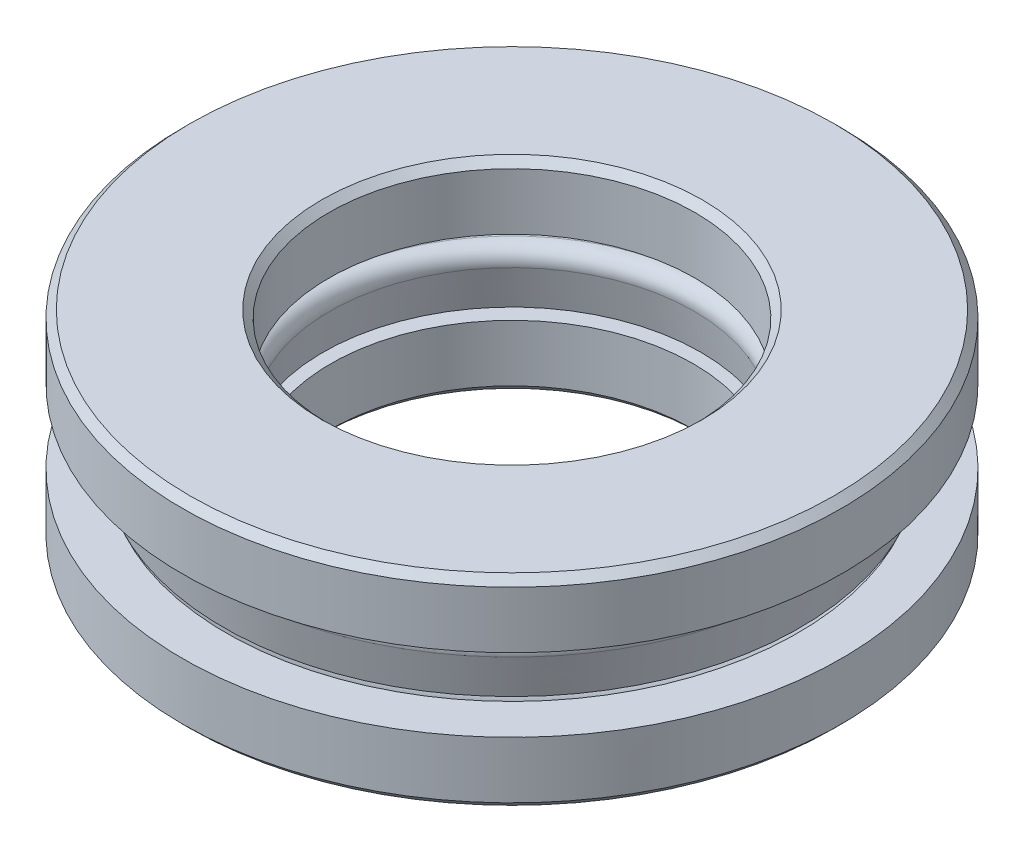
from build123d import *

# Parameters (mm, degrees)
PATTERN_CIRCULAR_2_COUNT = 8
CHAMFER_1_SIZE           = 0.2
CHAMFER_2_SIZE           = 0.2


with BuildPart() as part:
    # 草图4 → 旋转1 (revolve)
    with BuildSketch(Plane(origin=(0, 0, 0), x_dir=(0, 0, -1), z_dir=(1, 0, 0)), mode=Mode.PRIVATE) as revolve_1_sk:
        with BuildLine():
            Line((-4.95, -2.75), (-4.95, -1))
            Line((-4.95, -1), (-5.5, -1))
            ThreePointArc((-5.5, -1), (-6.65, -1.280202712), (-7.8, -1))
            Line((-7.8, -1), (-9, -1))
            Line((-9, -1), (-9, -2.75))
            Line((-9, -2.75), (-4.95, -2.75))
        make_face()
        with BuildLine():
            Line((-5, 2.75), (-9, 2.75))
            Line((-9, 2.75), (-9, 1))
            Line((-9, 1), (-7.8, 1))
            ThreePointArc((-7.8, 1), (-6.65, 1.280202712), (-5.5, 1))
            Line((-5.5, 1), (-5, 1))
            Line((-5, 1), (-5, 2.75))
        make_face()
    revolve(revolve_1_sk.sketch.rotate(Axis((0, -2.75, 0), (0, 1, 0)), 180), axis=Axis((0, -2.75, 0), (0, 1, 0)))

    # 倒角1
    chamfer_1_edges = [part.edges().sort_by_distance(p)[0] for p in [
        (0, 2.75, 9),
        (0, 2.75, 5),
    ]]
    chamfer(chamfer_1_edges, length=CHAMFER_1_SIZE)

    # 倒角2
    chamfer_2_edges = [part.edges().sort_by_distance(p)[0] for p in [
        (0, -2.75, 4.95),
        (0, -2.75, 9),
    ]]
    chamfer(chamfer_2_edges, length=CHAMFER_2_SIZE)


with BuildPart() as body_2:
    # 草图3 → 旋转2 (revolve)
    with BuildSketch(Plane(origin=(0, 0, 0), x_dir=(1, 0, 0), z_dir=(0, 1, 0))):
        with BuildLine():
            Line((0, 7.795), (0, 5.235))
            ThreePointArc((0, 5.235), (1.28, 6.515), (0, 7.795))
        make_face()
    revolve(axis=Axis((0, 0, -7.795), (0, 0, 1)))


with BuildPart() as pattern_circular_2_1:
    # 阵列(圆周)2: pattern copy
    add(body_2.part.rotate(Axis((0, 0, 0), (0, 1, 0)), 1 * 360 / PATTERN_CIRCULAR_2_COUNT))


with BuildPart() as pattern_circular_2_2:
    # 阵列(圆周)2: pattern copy
    add(body_2.part.rotate(Axis((0, 0, 0), (0, 1, 0)), 2 * 360 / PATTERN_CIRCULAR_2_COUNT))


with BuildPart() as pattern_circular_2_3:
    # 阵列(圆周)2: pattern copy
    add(body_2.part.rotate(Axis((0, 0, 0), (0, 1, 0)), 3 * 360 / PATTERN_CIRCULAR_2_COUNT))


with BuildPart() as pattern_circular_2_4:
    # 阵列(圆周)2: pattern copy
    add(body_2.part.rotate(Axis((0, 0, 0), (0, 1, 0)), 4 * 360 / PATTERN_CIRCULAR_2_COUNT))


with BuildPart() as pattern_circular_2_5:
    # 阵列(圆周)2: pattern copy
    add(body_2.part.rotate(Axis((0, 0, 0), (0, 1, 0)), 5 * 360 / PATTERN_CIRCULAR_2_COUNT))


with BuildPart() as pattern_circular_2_6:
    # 阵列(圆周)2: pattern copy
    add(body_2.part.rotate(Axis((0, 0, 0), (0, 1, 0)), 6 * 360 / PATTERN_CIRCULAR_2_COUNT))


with BuildPart() as pattern_circular_2_7:
    # 阵列(圆周)2: pattern copy
    add(body_2.part.rotate(Axis((0, 0, 0), (0, 1, 0)), 7 * 360 / PATTERN_CIRCULAR_2_COUNT))


with BuildPart() as body_10:
    # 草图5 → 旋转5 (revolve)
    with BuildSketch(Plane(origin=(0, 0, 0), x_dir=(0, 0, -1), z_dir=(1, 0, 0)), mode=Mode.PRIVATE) as revolve_5_sk:
        with BuildLine():
            Line((-7.861520386, 0.265270364), (-7.673684479, -0.8))
            Line((-7.673684479, -0.8), (-7.870646029, -0.834729636))
            Line((-7.870646029, -0.834729636), (-8.058481936, 0.230540729))
            ThreePointArc((-8.058481936, 0.230540729), (-7.970976612, 0.557115044), (-7.664558835, 0.7))
            Line((-7.664558835, 0.7), (-5.365441165, 0.7))
            ThreePointArc((-5.365441165, 0.7), (-5.059023388, 0.557115044), (-4.971518064, 0.230540729))
            Line((-4.971518064, 0.230540729), (-5.159353971, -0.834729636))
            Line((-5.159353971, -0.834729636), (-5.356315521, -0.8))
            Line((-5.356315521, -0.8), (-5.168479614, 0.265270364))
            ThreePointArc((-5.168479614, 0.265270364), (-5.212232276, 0.428557522), (-5.365441165, 0.5))
            Line((-5.365441165, 0.5), (-7.664558835, 0.5))
            ThreePointArc((-7.664558835, 0.5), (-7.817767724, 0.428557522), (-7.861520386, 0.265270364))
        make_face()
    revolve(revolve_5_sk.sketch.rotate(Axis((0, 0, 0), (0, 1, 0)), 180), axis=Axis((0, 0, 0), (0, 1, 0)))


solid = Compound([part.part, body_2.part, pattern_circular_2_1.part, pattern_circular_2_2.part, pattern_circular_2_3.part, pattern_circular_2_4.part, pattern_circular_2_5.part, pattern_circular_2_6.part, pattern_circular_2_7.part, body_10.part])
